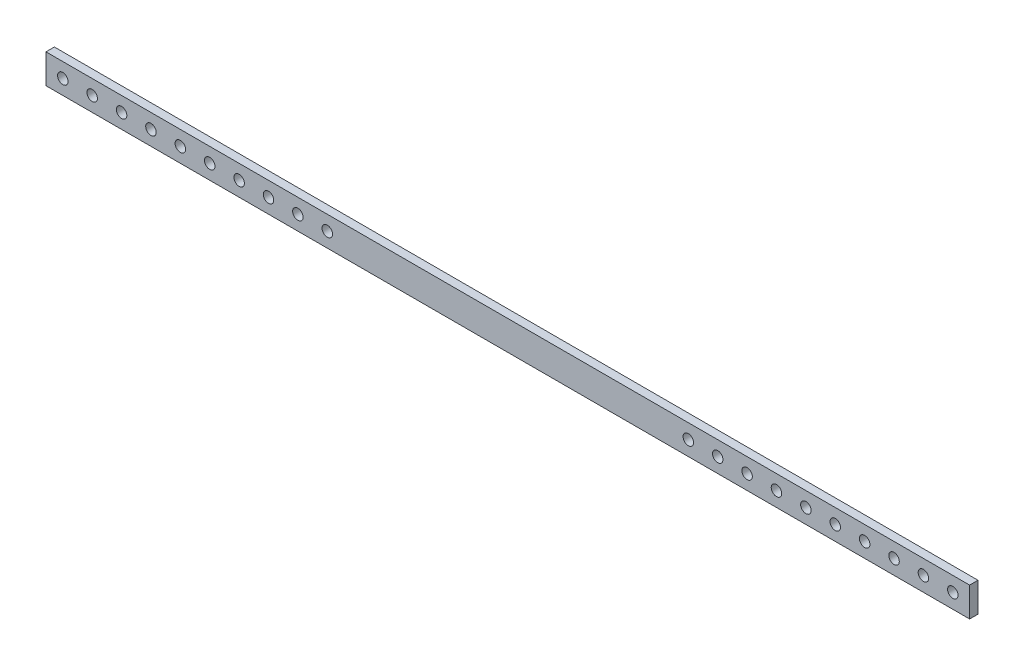
from build123d import *

# Parameters (mm, degrees)
SKETCH_1_W             = 220
SKETCH_1_H             = 7
EXTRUDE_1_DEPTH        = 2
PATTERN_LINEAR_2_COUNT = 10
PATTERN_LINEAR_2_PITCH = 7


with BuildPart() as part:
    # 草图1 → 凸台-拉伸1 (new body)
    with BuildSketch(Plane.XY):
        Rectangle(SKETCH_1_W, SKETCH_1_H)
    extrude(amount=EXTRUDE_1_DEPTH)

    # 草图6 → M3 螺纹孔2 (revolve, cut)
    with BuildSketch(Plane(origin=(-106, 0, 2), x_dir=(0, -1, 0), z_dir=(1, 0, 0))):
        Polygon((0, 0), (0, 8.251075774), (1.25, 7.5), (1.25, 0), align=None)
    hole_wizard_m3_2 = revolve(axis=Axis((-106, 0, 8.35), (0, 0, -1)), mode=Mode.SUBTRACT)

    # 阵列(线性)2: M3 螺纹孔2 ×10
    with Locations(*[(i * PATTERN_LINEAR_2_PITCH, 0, 0) for i in range(1, PATTERN_LINEAR_2_COUNT)]):
        add(hole_wizard_m3_2, mode=Mode.SUBTRACT)

    # 镜向1: M3 螺纹孔2 across plane
    add(hole_wizard_m3_2.mirror(Plane(origin=(0, 0, 0), x_dir=(0, 0, 1), z_dir=(1, 0, 0))), mode=Mode.SUBTRACT)

    # 镜向1 copy 1 sketch → 镜向1 copy 1 (revolve, cut)
    with BuildSketch(Plane(origin=(99, 0, 2), x_dir=(0, -1, 0), z_dir=(-1, 0, 0))):
        Polygon((0, 0), (0, -8.251075774), (1.25, -7.5), (1.25, 0), align=None)
    revolve(axis=Axis((99, 0, 8.35), (0, 0, 1)), mode=Mode.SUBTRACT)

    # 镜向1 copy 2 sketch → 镜向1 copy 2 (revolve, cut)
    with BuildSketch(Plane(origin=(92, 0, 2), x_dir=(0, -1, 0), z_dir=(-1, 0, 0))):
        Polygon((0, 0), (0, -8.251075774), (1.25, -7.5), (1.25, 0), align=None)
    revolve(axis=Axis((92, 0, 8.35), (0, 0, 1)), mode=Mode.SUBTRACT)

    # 镜向1 copy 3 sketch → 镜向1 copy 3 (revolve, cut)
    with BuildSketch(Plane(origin=(85, 0, 2), x_dir=(0, -1, 0), z_dir=(-1, 0, 0))):
        Polygon((0, 0), (0, -8.251075774), (1.25, -7.5), (1.25, 0), align=None)
    revolve(axis=Axis((85, 0, 8.35), (0, 0, 1)), mode=Mode.SUBTRACT)

    # 镜向1 copy 4 sketch → 镜向1 copy 4 (revolve, cut)
    with BuildSketch(Plane(origin=(78, 0, 2), x_dir=(0, -1, 0), z_dir=(-1, 0, 0))):
        Polygon((0, 0), (0, -8.251075774), (1.25, -7.5), (1.25, 0), align=None)
    revolve(axis=Axis((78, 0, 8.35), (0, 0, 1)), mode=Mode.SUBTRACT)

    # 镜向1 copy 5 sketch → 镜向1 copy 5 (revolve, cut)
    with BuildSketch(Plane(origin=(71, 0, 2), x_dir=(0, -1, 0), z_dir=(-1, 0, 0))):
        Polygon((0, 0), (0, -8.251075774), (1.25, -7.5), (1.25, 0), align=None)
    revolve(axis=Axis((71, 0, 8.35), (0, 0, 1)), mode=Mode.SUBTRACT)

    # 镜向1 copy 6 sketch → 镜向1 copy 6 (revolve, cut)
    with BuildSketch(Plane(origin=(64, 0, 2), x_dir=(0, -1, 0), z_dir=(-1, 0, 0))):
        Polygon((0, 0), (0, -8.251075774), (1.25, -7.5), (1.25, 0), align=None)
    revolve(axis=Axis((64, 0, 8.35), (0, 0, 1)), mode=Mode.SUBTRACT)

    # 镜向1 copy 7 sketch → 镜向1 copy 7 (revolve, cut)
    with BuildSketch(Plane(origin=(57, 0, 2), x_dir=(0, -1, 0), z_dir=(-1, 0, 0))):
        Polygon((0, 0), (0, -8.251075774), (1.25, -7.5), (1.25, 0), align=None)
    revolve(axis=Axis((57, 0, 8.35), (0, 0, 1)), mode=Mode.SUBTRACT)

    # 镜向1 copy 8 sketch → 镜向1 copy 8 (revolve, cut)
    with BuildSketch(Plane(origin=(50, 0, 2), x_dir=(0, -1, 0), z_dir=(-1, 0, 0))):
        Polygon((0, 0), (0, -8.251075774), (1.25, -7.5), (1.25, 0), align=None)
    revolve(axis=Axis((50, 0, 8.35), (0, 0, 1)), mode=Mode.SUBTRACT)

    # 镜向1 copy 9 sketch → 镜向1 copy 9 (revolve, cut)
    with BuildSketch(Plane(origin=(43, 0, 2), x_dir=(0, -1, 0), z_dir=(-1, 0, 0))):
        Polygon((0, 0), (0, -8.251075774), (1.25, -7.5), (1.25, 0), align=None)
    revolve(axis=Axis((43, 0, 8.35), (0, 0, 1)), mode=Mode.SUBTRACT)


solid = part.part
